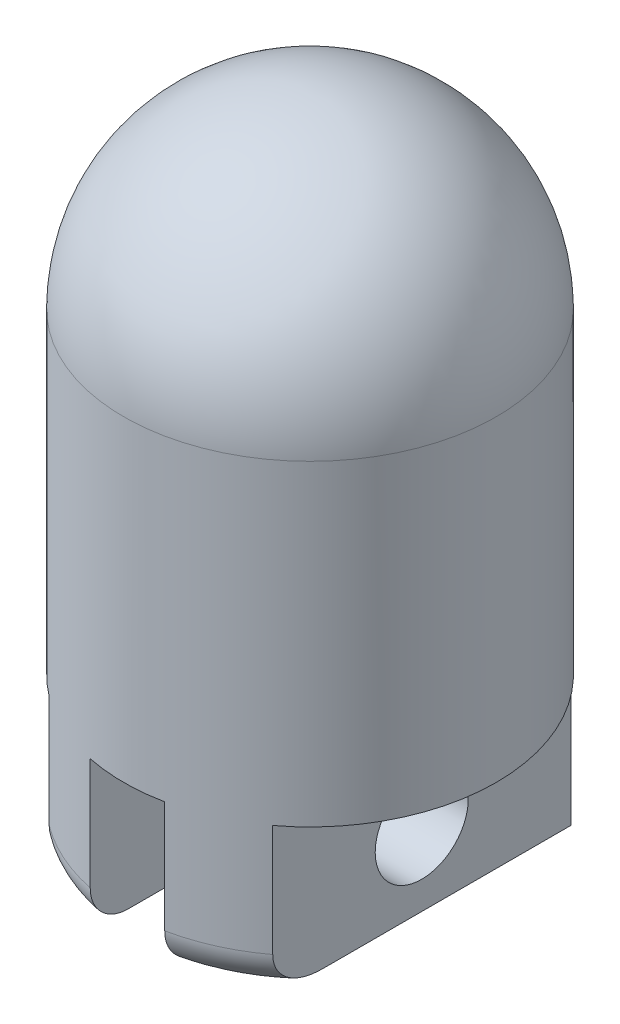
from build123d import *

# Parameters (mm, degrees)
CUT_EXTRUDE1_DEPTH = 10.16
SKETCH3_R          = 3.175
CUT_EXTRUDE2_DEPTH = 51.497474194
FILLET1_R          = 2.54


with BuildPart() as part:
    # Sketch1 → Revolve1 (revolve)
    with BuildSketch(Plane.XY):
        with BuildLine():
            Line((0, 0), (0, 5.602635041))
            Line((0, 5.602635041), (-2.54, 5.602635041))
            Line((-2.54, 5.602635041), (-2.54, 22.86))
            ThreePointArc((-2.54, 22.86), (-9.156372772, 33.032395282), (0, 40.995739559))
            Line((0, 40.995739559), (0, 44.45))
            ThreePointArc((0, 44.45), (-8.980256121, 40.730256121), (-12.7, 31.75))
            Line((-12.7, 31.75), (-12.7, 0))
            Line((-12.7, 0), (0, 0))
        make_face()
    revolve(axis=Axis((0, 0, 0), (0, 1, 0)))

    # Sketch2 → Cut-Extrude1 (cut)
    with BuildSketch(Plane.XZ):
        with BuildLine():
            Line((-2.54, 12.443407893), (-2.54, -12.443407893))
            ThreePointArc((-2.54, -12.443407893), (0, -12.7), (2.54, -12.443407893))
            Line((2.54, -12.443407893), (2.54, 12.443407893))
            ThreePointArc((2.54, 12.443407893), (0, 12.7), (-2.54, 12.443407893))
        make_face()
        with BuildLine():
            Line((-7.62, 10.16), (-7.62, -10.16))
            ThreePointArc((-7.62, -10.16), (-12.7, 0), (-7.62, 10.16))
        make_face()
        with BuildLine():
            Line((7.62, 10.16), (7.62, -10.16))
            ThreePointArc((7.62, -10.16), (12.7, 0), (7.62, 10.16))
        make_face()
    extrude(amount=-CUT_EXTRUDE1_DEPTH, mode=Mode.SUBTRACT)

    # Sketch3 → Cut-Extrude2 (cut, through all)
    with BuildSketch(Plane.ZY.offset(7.62)):
        with Locations((0, 5.08)):
            Circle(SKETCH3_R)
    extrude(amount=-CUT_EXTRUDE2_DEPTH, mode=Mode.SUBTRACT)

    # Fillet1
    fillet1_edges = [part.edges().sort_by_distance(p)[0] for p in [
        (5.206715654, 0, 11.583613948),
        (-5.206715654, 0, 11.583613948),
    ]]
    fillet(fillet1_edges, radius=FILLET1_R)


solid = part.part
